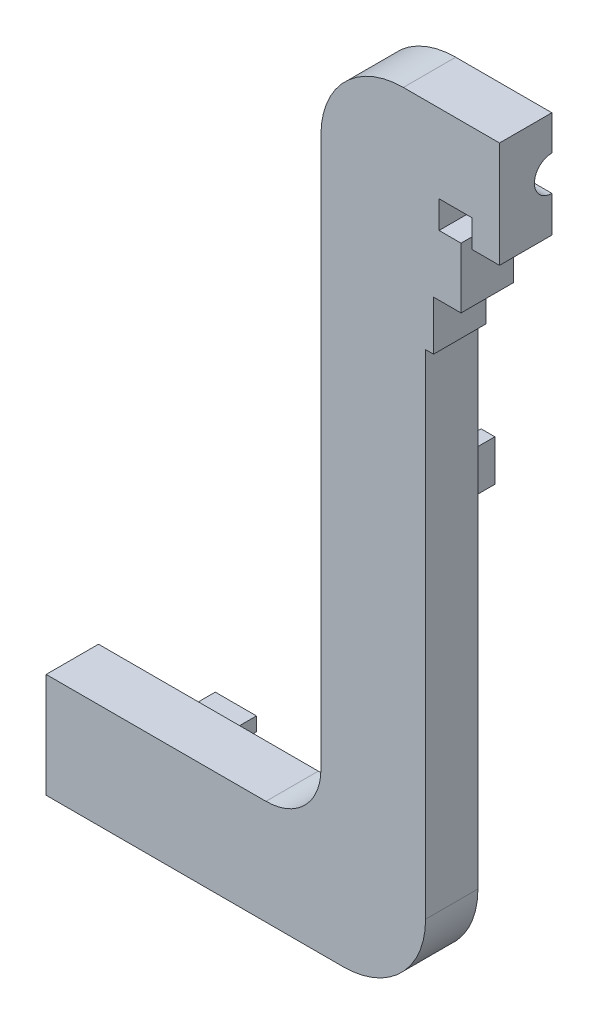
from build123d import *

# Parameters (mm, degrees)
BOSS_EXTRUDE1_DEPTH  = 19.05
CUT_SWEEP1_PROFILE_R = 6.35
FILLET1_R            = 30
FILLET2_R            = 20
SKETCH10_W           = 5
SKETCH10_H           = 15
SKETCH10_W_2         = 15
SKETCH10_H_2         = 5
BOSS_EXTRUDE2_DEPTH  = 10
FILLET3_R            = 1
BOSS_EXTRUDE3_DEPTH  = 19.05
SKETCH14_W           = 12
SKETCH14_H           = 10
CUT_EXTRUDE1_DEPTH   = 39


with BuildPart() as part:
    # Sketch1 → Boss-Extrude1 (new body)
    with BuildSketch(Plane.XY):
        Polygon((-100, 0), (0, 0), (0, 250), (65, 250), (65, 211.9), (38.1, 211.9), (38.1, -38.1), (-100, -38.1), align=None)
    extrude(amount=BOSS_EXTRUDE1_DEPTH)

    # Cut-Sweep1: sweep along a path in Sketch2
    with BuildLine(Plane(origin=(0, 0, 0), x_dir=(-1, 0, 0), z_dir=(0, 0, -1))) as cut_sweep1_path:
        Line((-65, 230.95), (-39.05, 230.95))
        ThreePointArc((-39.05, 230.95), (-24.907864376, 225.092135624), (-19.05, 210.95))
        Line((-19.05, 210.95), (-19.05, 0.95))
        ThreePointArc((-19.05, 0.95), (-13.192135624, -13.192135624), (0.95, -19.05))
        Line((0.95, -19.05), (100, -19.05))
    # Cut-Sweep1 profile (on start of the path) → Cut-Sweep1 (sweep, cut)
    with BuildSketch(Plane(origin=(65, 230.95, 0), x_dir=(0, 0, -1), z_dir=(-1, 0, 0))):
        Circle(CUT_SWEEP1_PROFILE_R)
    sweep(path=cut_sweep1_path.line, mode=Mode.SUBTRACT)

    # Fillet1
    fillet1_edges = [part.edges().sort_by_distance(p)[0] for p in [
        (0, 250, 9.525),
        (38.1, -38.1, 9.525),
    ]]
    fillet(fillet1_edges, radius=FILLET1_R)

    # Fillet2
    fillet2_edges = [part.edges().sort_by_distance(p)[0] for p in [
        (0, 0, 9.525),
    ]]
    fillet(fillet2_edges, radius=FILLET2_R)

    # Sketch10 → Boss-Extrude2 (add)
    with BuildSketch(Plane(origin=(0, 0, 0), x_dir=(-1, 0, 0), z_dir=(0, 0, -1))):
        with Locations((-6.35, 120)):
            Rectangle(SKETCH10_W, SKETCH10_H)
        with Locations((-31.75, 120)):
            Rectangle(SKETCH10_W, SKETCH10_H)
        with Locations((60, -6.35)):
            Rectangle(SKETCH10_W_2, SKETCH10_H_2)
        with Locations((60, -31.75)):
            Rectangle(SKETCH10_W_2, SKETCH10_H_2)
    extrude(amount=BOSS_EXTRUDE2_DEPTH)

    # Fillet3
    fillet3_edges = [part.edges().sort_by_distance(p)[0] for p in [
        (-67.5, -31.75, 0),
        (-60, -29.25, 0),
        (-52.5, -31.75, 0),
        (-60, -34.25, 0),
        (8.85, 120, 0),
        (6.35, 112.5, 0),
        (3.85, 120, 0),
        (6.35, 127.5, 0),
        (-52.5, -6.35, 0),
        (-60, -8.85, 0),
        (-67.5, -6.35, 0),
        (-60, -3.85, 0),
        (34.25, 120, 0),
        (31.75, 112.5, 0),
        (29.25, 120, 0),
        (31.75, 127.5, 0),
    ]]
    fillet(fillet3_edges, radius=FILLET3_R)

    # Sketch13 → Boss-Extrude3 (add)
    with BuildSketch(Plane.XY.offset(19.05)):
        Polygon((55, 221.425), (43, 221.425), (43, 211.425), (51, 211.425), (51, 189.425), (41, 189.425), (41, 171.425), (36.549895251, 171.425), (36.549895251, 223.572995821), (65, 223.572995821), (65, 211.9), (65, 211.425), (55, 211.425), align=None)
    extrude(amount=-BOSS_EXTRUDE3_DEPTH)

    # Sketch14 → Cut-Extrude1 (cut)
    with BuildSketch(Plane.XY.offset(19.05)):
        with Locations((49, 216.42)):
            Rectangle(SKETCH14_W, SKETCH14_H)
    extrude(amount=-CUT_EXTRUDE1_DEPTH, mode=Mode.SUBTRACT)


solid = part.part
